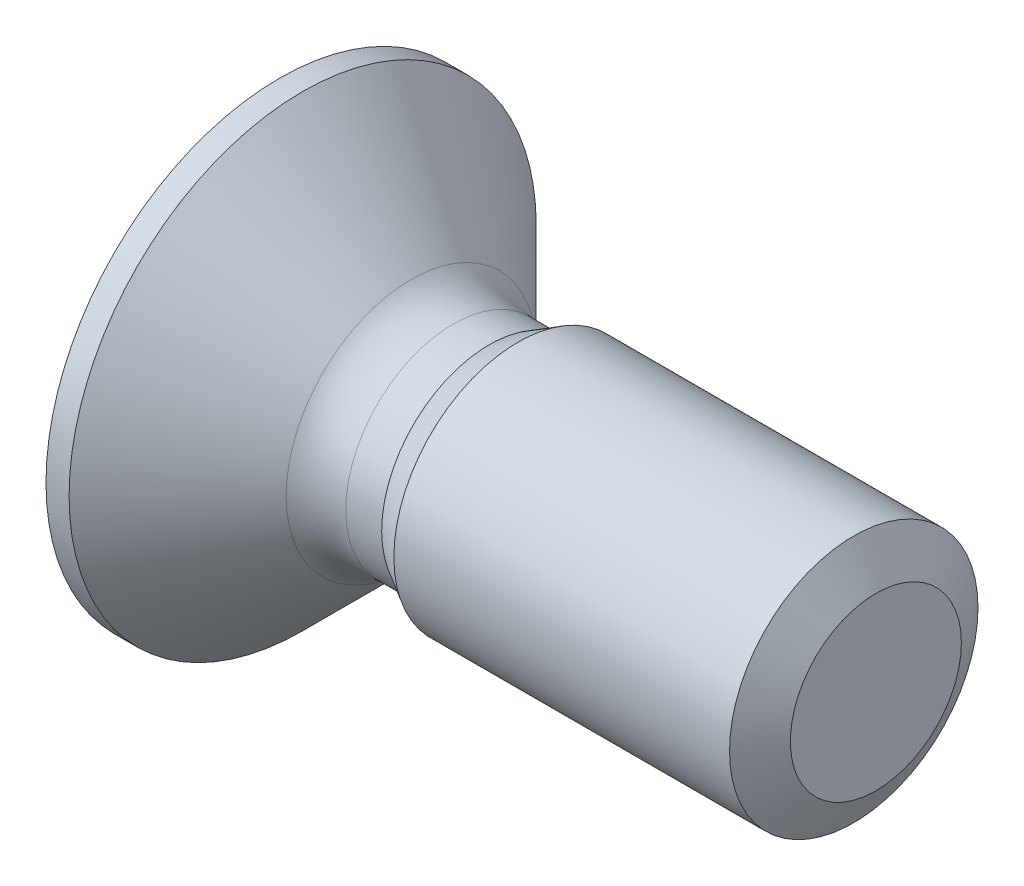
from build123d import *

# Parameters (mm, degrees)
PATTERN_CIRCULAR_1_COUNT = 2
PATTERN_CIRCULAR_1_ANGLE = 90


with BuildPart() as part:
    # 草图1 → Revolve 694 (revolve)
    with BuildSketch(Plane.XY, mode=Mode.PRIVATE) as revolve_694_sk:
        with BuildLine():
            Line((0, 0), (0, 2.35))
            Line((0, 2.35), (0.2325, 2.35))
            Line((0.2325, 2.35), (1.324264069, 1.258235931))
            ThreePointArc((1.324264069, 1.258235931), (1.518918078, 1.12817228), (1.748528137, 1.0825))
            Line((1.748528137, 1.0825), (2.10988149, 1.0825))
            Line((2.10988149, 1.0825), (2.4, 1.25))
            Line((2.4, 1.25), (6, 1.25))
            Line((6, 1.25), (6, 0))
            Line((6, 0), (0, 0))
        make_face()
    revolve(revolve_694_sk.sketch.rotate(Axis((0, 0, 0), (1, 0, 0)), 90), axis=Axis((0, 0, 0), (1, 0, 0)))

    # 草图2 → 切除-旋转1 (revolve, cut)
    with BuildSketch(Plane.XY, mode=Mode.PRIVATE) as cut_revolve_1_sk:
        Polygon((5.777437203, 1.25), (6.227437203, 1.25), (6, 0.8603), align=None)
    revolve(cut_revolve_1_sk.sketch.rotate(Axis((0, 0, 0), (-1, 0, 0)), 270), axis=Axis((0, 0, 0), (-1, 0, 0)), mode=Mode.SUBTRACT)

    # 草图3 → 切除-放样1 section 0
    with BuildSketch(Plane.ZY, mode=Mode.PRIVATE) as loft_1_s0:
        with BuildLine():
            Line((-1.45, 0.225), (1.45, 0.225))
            Line((1.45, 0.225), (1.45, -0.225))
            Line((1.45, -0.225), (-1.45, -0.225))
            Line((-1.45, -0.225), (-1.45, 0.225))
        make_face()
    loft_1 = loft([loft_1_s0.sketch, Vertex(1.8, 0, 0)], mode=Mode.SUBTRACT)

    # 阵列(圆周)1: 切除-放样1 ×2 about axis
    pattern_circular_1_axis = Axis((0, 0, 0), (1, 0, 0))
    for i in range(1, PATTERN_CIRCULAR_1_COUNT):
        add(loft_1.rotate(pattern_circular_1_axis, i * PATTERN_CIRCULAR_1_ANGLE / (PATTERN_CIRCULAR_1_COUNT - 1)), mode=Mode.SUBTRACT)


solid = part.part
